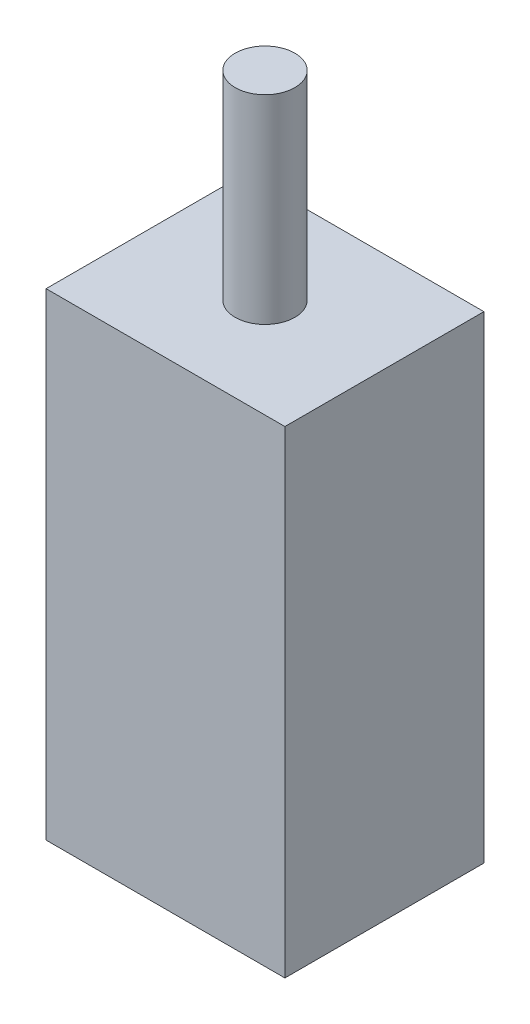
from build123d import *

# Parameters (mm, degrees)
SKETCH1_W           = 24
SKETCH1_H           = 12
BOSS_EXTRUDE1_DEPTH = 5
SKETCH2_R           = 1.5
BOSS_EXTRUDE2_DEPTH = 10
SKETCH3_W           = 0.2
SKETCH3_H           = 1
BOSS_EXTRUDE3_DEPTH = 1


with BuildPart() as part:
    # Sketch1 → Boss-Extrude1 (new, symmetric)
    with BuildSketch(Plane(origin=(0, 0, 0), x_dir=(0, 1, 0), z_dir=(0, 0, 1))):
        Rectangle(SKETCH1_W, SKETCH1_H)
    extrude(amount=BOSS_EXTRUDE1_DEPTH, both=True)

    # Sketch2 → Boss-Extrude2 (add)
    with BuildSketch(Plane(origin=(0, 12, 0), x_dir=(-1, 0, 0), z_dir=(0, 1, 0))):
        with Locations(Location((0, 0, 0), (0, 0, 90))):
            Circle(SKETCH2_R)
    extrude(amount=BOSS_EXTRUDE2_DEPTH)

    # Sketch3 → Boss-Extrude3 (add)
    with BuildSketch(Plane.XZ.offset(12)):
        with Locations((4.1, 0)):
            Rectangle(SKETCH3_W, SKETCH3_H)
        with Locations((-4.1, 0)):
            Rectangle(SKETCH3_W, SKETCH3_H)
    extrude(amount=BOSS_EXTRUDE3_DEPTH)


solid = part.part
